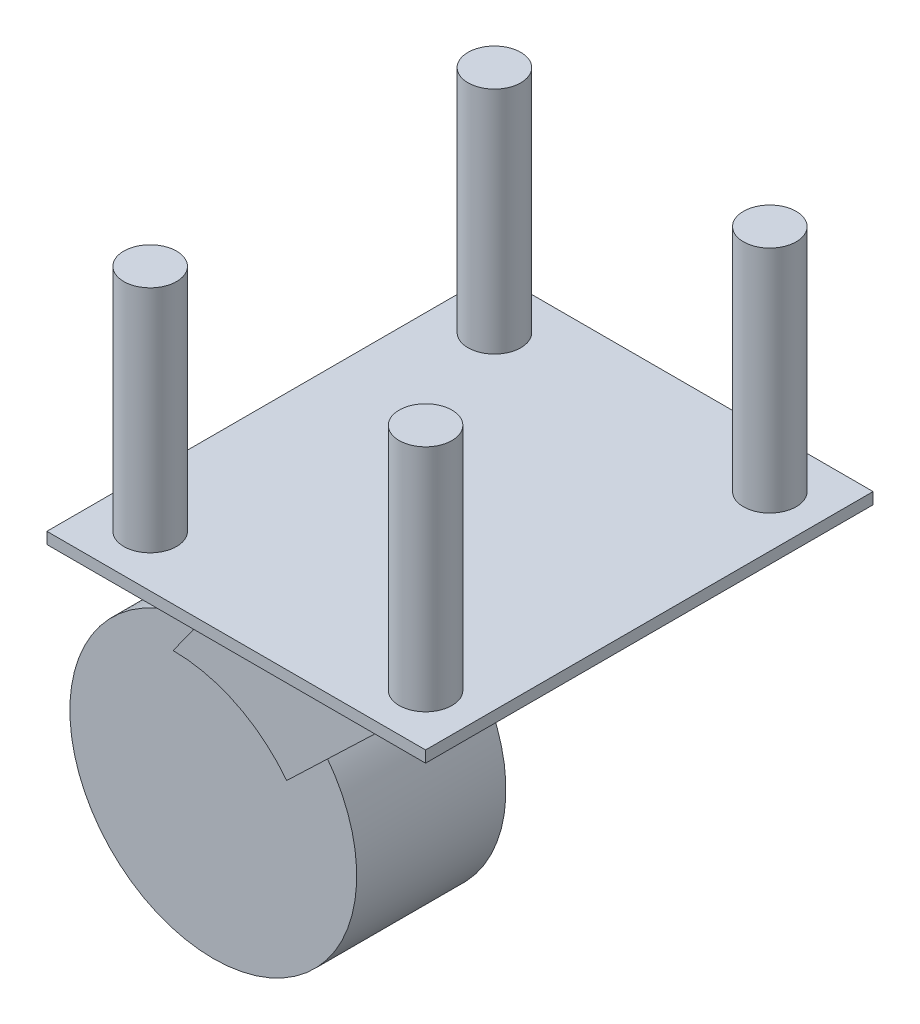
from build123d import *

# Parameters (mm, degrees)
SKETCH_1_W          = 33
SKETCH_1_H          = 39
EXTRUDE_1_DEPTH     = 1
SKETCH_2_R          = 12.5
EXTRUDE_2_DEPTH     = 6.5
EXTRUDE_3_DEPTH     = 10
SKETCH_4_R          = 2.3
EXTRUDE_4_DEPTH     = 20
SKETCH_5_OUTSIDE_W  = 62.518
SKETCH_5_OUTSIDE_H  = 57.518
SKETCH_5_OUTSIDE_R  = 12.5
CUT_EXTRUDE_1_DEPTH = 5


with BuildPart() as part:
    # 草图1 → 凸台-拉伸1 (new body)
    with BuildSketch(Plane(origin=(0, 0, 0), x_dir=(1, 0, 0), z_dir=(0, 1, 0))):
        Rectangle(SKETCH_1_W, SKETCH_1_H)
    extrude(amount=EXTRUDE_1_DEPTH)



with BuildPart() as body_2:
    # 草图2 → 凸台-拉伸2 (new, symmetric)
    with BuildSketch(Plane.XY):
        with Locations(Location((-15, -24.5, 0), (0, 0, 180))):
            Circle(SKETCH_2_R)
    extrude(amount=EXTRUDE_2_DEPTH, both=True)


with BuildPart() as part_1:
    add(part.part)

    add(body_2.part)  # 凸台-拉伸3 merges body 2
    # 草图3 → 凸台-拉伸3 (add, symmetric)
    with BuildSketch(Plane.XY):
        with BuildLine():
            Line((-12.5, 0), (-11.111866784, -6.574487566))
            Line((-11.111866784, -6.574487566), (-15, -12))
            ThreePointArc((-15, -12), (-9.487173184, -13.281321802), (-5.104539199, -16.86260152))
            Line((-5.104539199, -16.86260152), (12.5, 0))
            Line((12.5, 0), (-12.5, 0))
        make_face()
    extrude(amount=EXTRUDE_3_DEPTH, both=True)

    # 草图4 → 凸台-拉伸4 (add)
    with BuildSketch(Plane(origin=(0, 1, 0), x_dir=(1, 0, 0), z_dir=(0, 1, 0))):
        with Locations(Location((-12, 15, 0), (0, 0, 270))):
            Circle(SKETCH_4_R)
        with Locations(Location((12, 15, 0), (0, 0, 270))):
            Circle(SKETCH_4_R)
        with Locations(Location((-12, -15, 0), (0, 0, 270))):
            Circle(SKETCH_4_R)
        with Locations(Location((12, -15, 0), (0, 0, 270))):
            Circle(SKETCH_4_R)
    extrude(amount=EXTRUDE_4_DEPTH)

    # 草图5 outside → 切除-拉伸1 (cut)
    with BuildSketch(Plane.XZ):
        with Locations((-5.5, 0)):
            Rectangle(SKETCH_5_OUTSIDE_W, SKETCH_5_OUTSIDE_H)
        Circle(SKETCH_5_OUTSIDE_R, mode=Mode.SUBTRACT)
    extrude(amount=CUT_EXTRUDE_1_DEPTH, mode=Mode.SUBTRACT)


solid = part_1.part
